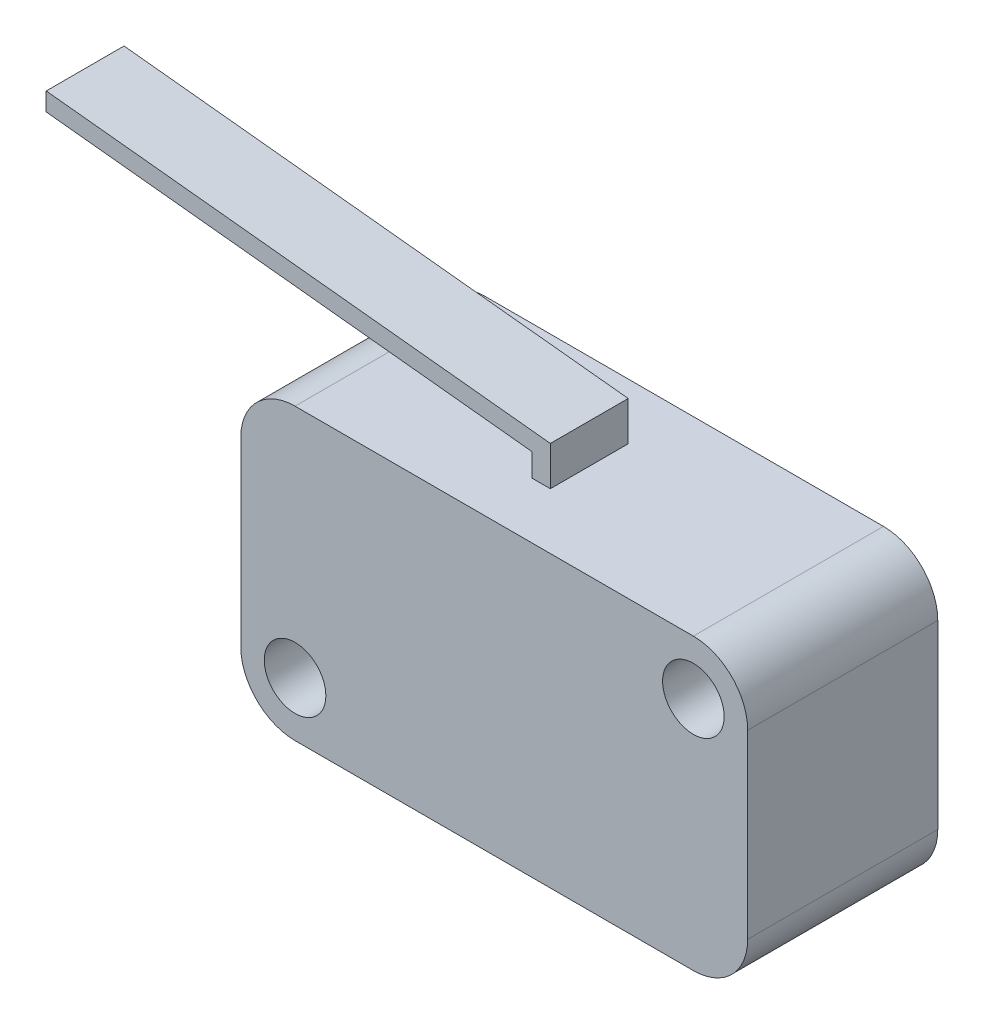
from build123d import *

# Parameters (mm, degrees)
SKETCH_1_W          = 28
SKETCH_1_H          = 16
EXTRUDE_1_DEPTH     = 10.5
SKETCH_2_R          = 1.7
CUT_EXTRUDE_1_DEPTH = 10.5
FILLET_1_R          = 3
EXTRUDE_2_DEPTH     = 10.5
SKETCH_4_W          = 27.845387087
SKETCH_4_H          = 5.10555255
CUT_EXTRUDE_2_DEPTH = 3.1
SKETCH_5_W          = 33.643456051
SKETCH_5_H          = 7.59321446
CUT_EXTRUDE_3_DEPTH = 3.1


with BuildPart() as part:
    # 草图1 → 凸台-拉伸1 (new body)
    with BuildSketch(Plane.XY):
        Rectangle(SKETCH_1_W, SKETCH_1_H)
    extrude(amount=EXTRUDE_1_DEPTH)

    # 草图2 → 切除-拉伸1 (cut)
    with BuildSketch(Plane.XY.offset(10.5)):
        with Locations((-11, -5)):
            Circle(SKETCH_2_R)
        with Locations((11, 5)):
            Circle(SKETCH_2_R)
    extrude(amount=-CUT_EXTRUDE_1_DEPTH, mode=Mode.SUBTRACT)

    # 圆角1
    fillet_1_edges = [part.edges().sort_by_distance(p)[0] for p in [
        (-14, 8, 5.25),
        (14, 8, 5.25),
        (14, -8, 5.25),
        (-14, -8, 5.25),
    ]]
    fillet(fillet_1_edges, radius=FILLET_1_R)

    # 草图3 → 凸台-拉伸2 (add)
    with BuildSketch(Plane.XY):
        Polygon((0, 8), (0, 10.167114537), (-27.845387087, 13.10555255), (-27.845387087, 12.1), (-1, 9.267088909), (-1, 8), align=None)
    extrude(amount=EXTRUDE_2_DEPTH)

    # 草图4 → 切除-拉伸2 (cut)
    with BuildSketch(Plane.XY.offset(10.5)):
        with Locations((-13.922693544, 10.552776275)):
            Rectangle(SKETCH_4_W, SKETCH_4_H)
    extrude(amount=-CUT_EXTRUDE_2_DEPTH, mode=Mode.SUBTRACT)

    # 草图5 → 切除-拉伸3 (cut)
    with BuildSketch(Plane(origin=(0, 0, 0), x_dir=(-1, 0, 0), z_dir=(0, 0, -1))):
        with Locations((16.821728026, 11.79660723)):
            Rectangle(SKETCH_5_W, SKETCH_5_H)
    extrude(amount=-CUT_EXTRUDE_3_DEPTH, mode=Mode.SUBTRACT)


solid = part.part
